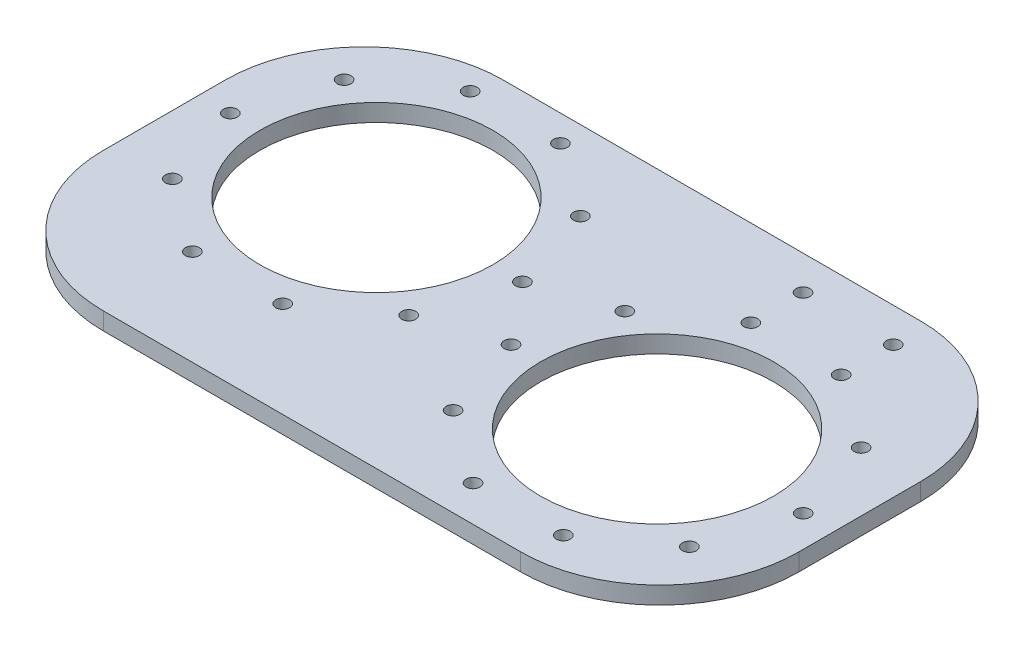
from build123d import *

# Parameters (mm, degrees)
SKETCH_1_R               = 33.5
EXTRUDE_1_DEPTH          = 5
CUT_EXTRUDE_1_REACH      = 117.461
SKETCH_2_R               = 2
PATTERN_CIRCULAR_1_COUNT = 10
CUT_EXTRUDE_2_REACH      = 117.461
SKETCH_3_R               = 2
PATTERN_CIRCULAR_2_COUNT = 10
CUT_EXTRUDE_3_REACH      = 117.461
SKETCH_4_R               = 2


with BuildPart() as part:
    # 草圖1 → 填料-伸長1 (new body)
    with BuildSketch(Plane(origin=(0, 0, 0), x_dir=(1, 0, 0), z_dir=(0, 1, 0))):
        with BuildLine():
            Line((-60, 57.5), (60, 57.5))
            ThreePointArc((60, 57.5), (88.284271247, 45.784271247), (100, 17.5))
            Line((100, 17.5), (100, -17.5))
            ThreePointArc((100, -17.5), (88.284271247, -45.784271247), (60, -57.5))
            Line((60, -57.5), (-60, -57.5))
            ThreePointArc((-60, -57.5), (-88.284271247, -45.784271247), (-100, -17.5))
            Line((-100, -17.5), (-100, 17.5))
            ThreePointArc((-100, 17.5), (-88.284271247, 45.784271247), (-60, 57.5))
        make_face()
        with Locations(Location((-49, 10, 0), (0, 0, 270))):
            Circle(SKETCH_1_R, mode=Mode.SUBTRACT)
        with Locations(Location((49, -7.280044109, 0), (0, 0, 270))):
            Circle(SKETCH_1_R, mode=Mode.SUBTRACT)
    extrude(amount=EXTRUDE_1_DEPTH)

    # 草圖2 → 除料-伸長1 (cut, up to next)
    with BuildSketch(Plane(origin=(0, 5, 0), x_dir=(1, 0, 0), z_dir=(0, 1, 0)), mode=Mode.PRIVATE) as cut_extrude_1_sk1:
        with Locations(Location((91, -7.280044109, 0), (0, 0, 270))):
            Circle(SKETCH_2_R)
    cut_extrude_1_tool1 = extrude(cut_extrude_1_sk1.sketch, amount=-CUT_EXTRUDE_1_REACH, mode=Mode.PRIVATE) & part.part
    cut_extrude_1 = cut_extrude_1_tool1.solids().sort_by_distance((91, 5, 7.280044))[0]
    add(cut_extrude_1, mode=Mode.SUBTRACT)

    # 環狀複製排列1: 除料-伸長1 ×10 about axis
    pattern_circular_1_axis = Axis((49, 0, 7.280044109), (0, 1, 0))
    for i in range(1, PATTERN_CIRCULAR_1_COUNT):
        add(cut_extrude_1.rotate(pattern_circular_1_axis, i * 360 / PATTERN_CIRCULAR_1_COUNT), mode=Mode.SUBTRACT)

    # 草圖3 → 除料-伸長2 (cut, up to next)
    with BuildSketch(Plane(origin=(0, 5, 0), x_dir=(1, 0, 0), z_dir=(0, 1, 0)), mode=Mode.PRIVATE) as cut_extrude_2_sk1:
        with Locations(Location((-7, 10, 0), (0, 0, 270))):
            Circle(SKETCH_3_R)
    cut_extrude_2_tool1 = extrude(cut_extrude_2_sk1.sketch, amount=-CUT_EXTRUDE_2_REACH, mode=Mode.PRIVATE) & part.part
    cut_extrude_2 = cut_extrude_2_tool1.solids().sort_by_distance((-7, 5, -10))[0]
    add(cut_extrude_2, mode=Mode.SUBTRACT)

    # 環狀複製排列2: 除料-伸長2 ×10 about axis
    pattern_circular_2_axis = Axis((-49, 0, -10), (0, 1, 0))
    for i in range(1, PATTERN_CIRCULAR_2_COUNT):
        add(cut_extrude_2.rotate(pattern_circular_2_axis, i * 360 / PATTERN_CIRCULAR_2_COUNT), mode=Mode.SUBTRACT)

    # 草圖4 → 除料-伸長3 (cut, up to next)
    with BuildSketch(Plane(origin=(0, 5, 0), x_dir=(1, 0, 0), z_dir=(0, 1, 0)), mode=Mode.PRIVATE) as cut_extrude_3_sk1:
        with Locations(Location((36.021286236, 47.664329575, 0), (0, 0, 270))):
            Circle(SKETCH_4_R)
    cut_extrude_3_tool1 = extrude(cut_extrude_3_sk1.sketch, amount=-CUT_EXTRUDE_3_REACH, mode=Mode.PRIVATE) & part.part
    # 草圖4 → 除料-伸長3 (cut, up to next)
    with BuildSketch(Plane(origin=(0, 5, 0), x_dir=(1, 0, 0), z_dir=(0, 1, 0)), mode=Mode.PRIVATE) as cut_extrude_3_sk2:
        with Locations(Location((61.978713764, 47.664329575, 0), (0, 0, 270))):
            Circle(SKETCH_4_R)
    cut_extrude_3_tool2 = extrude(cut_extrude_3_sk2.sketch, amount=-CUT_EXTRUDE_3_REACH, mode=Mode.PRIVATE) & part.part
    add(cut_extrude_3_tool1.solids().sort_by_distance((36.021286, 5, -47.66433))[0], mode=Mode.SUBTRACT)
    add(cut_extrude_3_tool2.solids().sort_by_distance((61.978714, 5, -47.66433))[0], mode=Mode.SUBTRACT)


solid = part.part
